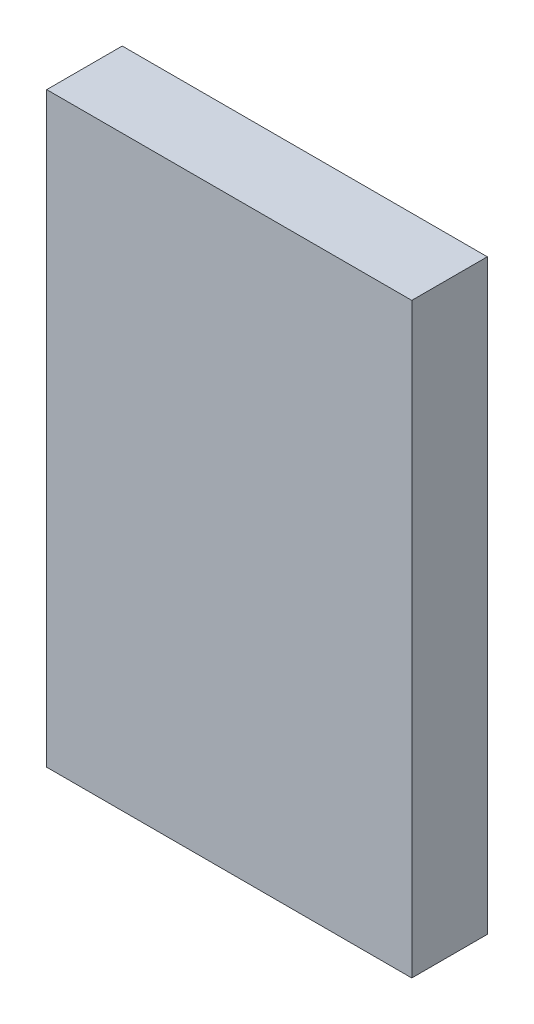
from build123d import *

# Parameters (mm, degrees)
BOSS_EXTRUDE1_DEPTH = 3


with BuildPart() as part:
    # Sketch1 → Boss-Extrude1 (new body)
    with BuildSketch(Plane.XY):
        Polygon((-7.206431168, -7.130585607), (-7.206431168, 13.369414393), (7.293568832, 13.369414393), (7.293568832, -6.939685402), (7.293568832, -9.939685402), (-7.206431168, -9.939685402), align=None)
    extrude(amount=BOSS_EXTRUDE1_DEPTH)


solid = part.part
